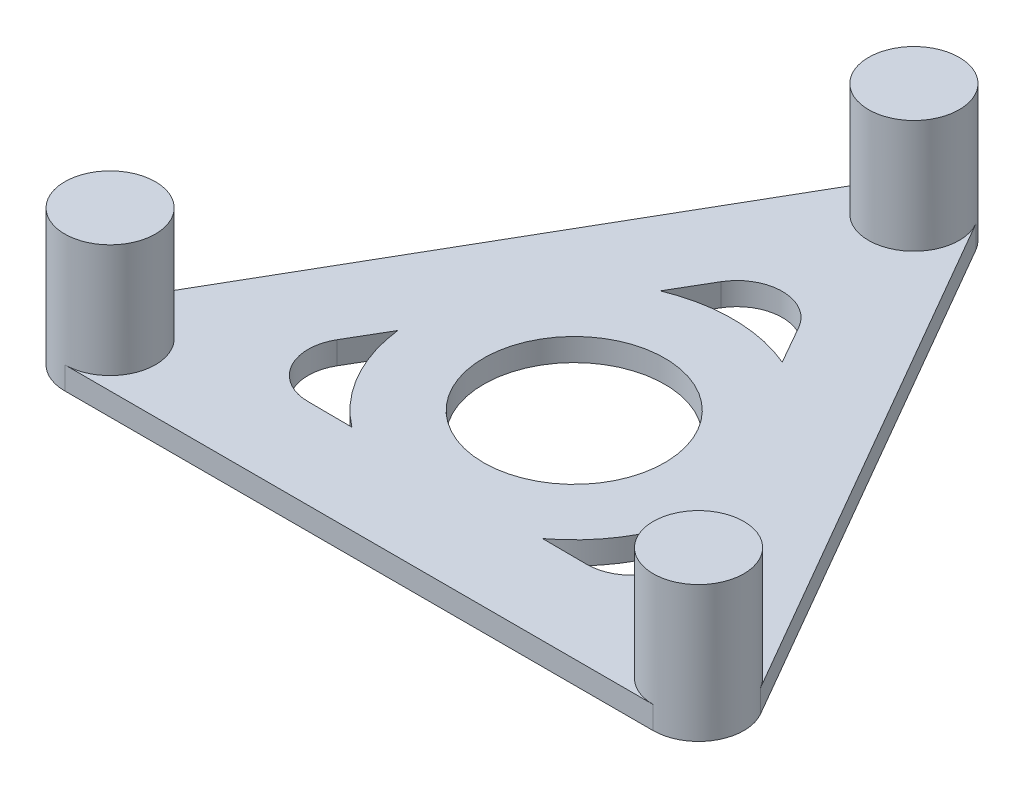
from build123d import *

# Parameters (mm, degrees)
SKETCH1_R           = 4
BOSS_EXTRUDE1_DEPTH = 1
SKETCH3_R           = 2.001662742
BOSS_EXTRUDE2_DEPTH = 6


with BuildPart() as part:
    # Sketch1 → Boss-Extrude1 (new body)
    with BuildSketch(Plane(origin=(0, 0, 0), x_dir=(1, 0, 0), z_dir=(0, 1, 0))):
        with BuildLine():
            Line((-1.733490784, 16.000831371), (-14.723871841, -6.499168629))
            ThreePointArc((-14.723871841, -6.499168629), (-12.472312617, -5.566542262), (-10.988718315, -7.5))
            ThreePointArc((-10.988718315, -7.5), (-11.574991759, -8.915389298), (-12.990381057, -9.501662742))
            Line((-12.990381057, -9.501662742), (12.990381057, -9.501662742))
            ThreePointArc((12.990381057, -9.501662742), (11.256890273, -6.499168629), (14.723871841, -6.499168629))
            Line((14.723871841, -6.499168629), (1.733490784, 16.000831371))
            ThreePointArc((1.733490784, 16.000831371), (1.933457738, 15.518068439), (2.001662742, 15))
            ThreePointArc((2.001662742, 15), (-0.518068439, 13.066542262), (-1.733490784, 16.000831371))
        make_face()
        with BuildLine():
            ThreePointArc((-6.22231578, -5.537682874), (-7.948518941, -4.527622159), (-7.936882283, -2.527656013))
            Line((-7.936882283, -2.527656013), (-6.949410322, -0.840057244))
            ThreePointArc((-6.949410322, -0.840057244), (-6.082439366, -3.464669011), (-4.267076395, -5.549059293))
            Line((-4.267076395, -5.549059293), (-6.22231578, -5.537682874))
        make_face(mode=Mode.SUBTRACT)
        with Locations(Location((0, 0, 0), (0, 0, 270))):
            Circle(SKETCH1_R, mode=Mode.SUBTRACT)
        with BuildLine():
            ThreePointArc((7.906931938, -2.619842099), (7.895295279, -4.619808246), (6.15745546, -5.609713677))
            Line((6.15745546, -5.609713677), (4.202216075, -5.598337258))
            ThreePointArc((4.202216075, -5.598337258), (6.041711062, -3.535212503), (6.939164513, -0.920866911))
            Line((6.939164513, -0.920866911), (7.906931938, -2.619842099))
        make_face(mode=Mode.SUBTRACT)
        with BuildLine():
            ThreePointArc((-1.684616157, 8.157524973), (0.053223662, 9.147430405), (1.779426822, 8.13736969))
            Line((1.779426822, 8.13736969), (2.747194247, 6.438394502))
            ThreePointArc((2.747194247, 6.438394502), (0.040728304, 6.999881514), (-2.672088118, 6.469926204))
            Line((-2.672088118, 6.469926204), (-1.684616157, 8.157524973))
        make_face(mode=Mode.SUBTRACT)
    extrude(amount=BOSS_EXTRUDE1_DEPTH)

    # Sketch3 → Boss-Extrude2 (add)
    with BuildSketch(Plane.XZ):
        with Locations(Location((-12.990381057, 7.5, 0), (0, 0, 270))):
            Circle(SKETCH3_R)
        with Locations(Location((12.990381057, 7.5, 0), (0, 0, 270))):
            Circle(SKETCH3_R)
        with Locations(Location((0, -15, 0), (0, 0, 270))):
            Circle(SKETCH3_R)
    extrude(amount=-BOSS_EXTRUDE2_DEPTH)


solid = part.part
